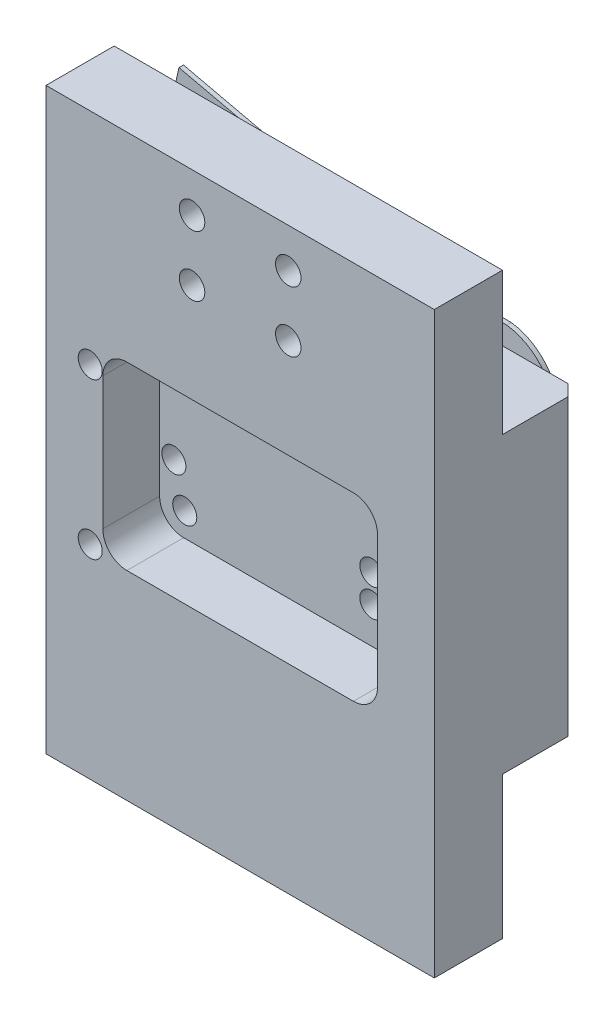
from build123d import *

# Parameters (mm, degrees)
CROQUIS1_R                 = 4.430496459
CROQUIS1_R_2               = 2.021537648
CROQUIS1_R_3               = 2.872174668
CROQUIS1_R_4               = 2.680697474
CROQUIS1_R_5               = 2.776444448
CROQUIS1_R_6               = 2.106249137
CROQUIS1_R_7               = 2.790383016
SALIENTE_EXTRUIR1_DEPTH    = 1.19
CROQUIS7_W                 = 102.52
CROQUIS7_H                 = 77.67
SALIENTE_EXTRUIR2_DEPTH    = 38.3
CROQUIS9_W                 = 102.52
CROQUIS9_H                 = 152.854
SALIENTE_EXTRUIR3_DEPTH    = 18
CROQUIS10_W                = 72.52
CROQUIS10_H                = 47.67
CORTAR_EXTRUIR2_DEPTH      = 15
CROQUIS8_R                 = 2.021537648
CROQUIS8_R_2               = 2.680697474
CROQUIS8_R_3               = 2.106249137
CROQUIS8_R_4               = 2.790383016
CORTAR_EXTRUIR3_DEPTH      = 3118.224162973
REDONDEO1_R                = 6.35
CROQUIS8_7_R               = 3.175
CORTAR_EXTRUIR4_DEPTH      = 38.3
CROQUIS11_R                = 3.175
CORTAR_EXTRUIR5_DEPTH      = 5
CHAFL_N1_SIZE              = 3
CORTAR_EXTRUIR6_DEPTH      = 3118.147929169
CORTAR_EXTRUIR6_DEPTH_BACK = 3118.147929169
CROQUIS12_R                = 3.3655
CORTAR_EXTRUIR7_DEPTH      = 3.0988
CROQUIS11_5_R              = 3.175
CORTAR_EXTRUIR8_DEPTH      = 3118.179679185


with BuildPart() as part:
    # Croquis1 → Saliente-Extruir1 (new body)
    with BuildSketch(Plane.XY):
        with BuildLine():
            Line((2788.515923591, 1163.062896503), (2845.320282862, 1163.062896503))
            ThreePointArc((2845.320282862, 1163.062896503), (2854.380265752, 1158.219977336), (2857.861371877, 1148.554623946))
            Line((2857.861371877, 1148.554623946), (2857.861371877, 1105.884683704))
            Line((2857.861371877, 1105.884683704), (2859.709564321, 1099.969499723))
            Line((2859.709564321, 1099.969499723), (2859.709564321, 1086.668463787))
            Line((2859.709564321, 1086.668463787), (2831.925019811, 1086.668463787))
            Line((2831.925019811, 1086.668463787), (2831.925019811, 1090.237043102))
            ThreePointArc((2831.925019811, 1090.237043102), (2830.339855276, 1092.909707682), (2827.46732338, 1094.094799688))
            Line((2827.46732338, 1094.094799688), (2781.073788136, 1094.094799688))
            ThreePointArc((2781.073788136, 1094.094799688), (2777.943377157, 1096.10205762), (2777.077273901, 1099.718467781))
            Line((2777.077273901, 1099.718467781), (2777.077273901, 1139.357764533))
            ThreePointArc((2777.077273901, 1139.357764533), (2776.16191908, 1141.931561181), (2774.31245647, 1143.941981956))
            Line((2774.31245647, 1143.941981956), (2760.508490421, 1156.27030536))
            Line((2760.508490421, 1156.27030536), (2756.869619555, 1168.884626052))
            ThreePointArc((2756.869619555, 1168.884626052), (2756.826740412, 1171.777711215), (2757.827792947, 1174.492425601))
            Line((2757.827792947, 1174.492425601), (2758.788780948, 1178.67068333))
            Line((2758.788780948, 1178.67068333), (2784.893128388, 1172.66675387))
            Line((2784.893128388, 1172.66675387), (2784.19129322, 1169.615260811))
            ThreePointArc((2784.19129322, 1169.615260811), (2784.56217485, 1165.156713392), (2788.515923591, 1163.062896503))
        make_face()
        with Locations((2819.601763615, 1133.235396685)):
            Circle(CROQUIS1_R, mode=Mode.SUBTRACT)
        with Locations((2790.727223865, 1121.638053324)):
            Circle(CROQUIS1_R_2, mode=Mode.SUBTRACT)
        with Locations((2783.65094449, 1147.375154376)):
            Circle(CROQUIS1_R_3, mode=Mode.SUBTRACT)
        with Locations((2793.607825607, 1111.419307874)):
            Circle(CROQUIS1_R_4, mode=Mode.SUBTRACT)
        with Locations((2783.65094449, 1106.253651095)):
            Circle(CROQUIS1_R_3, mode=Mode.SUBTRACT)
        with Locations((2842.913546585, 1132.266044758)):
            Circle(CROQUIS1_R_5, mode=Mode.SUBTRACT)
        with Locations((2843.009293559, 1122.033928625)):
            Circle(CROQUIS1_R_6, mode=Mode.SUBTRACT)
        with Locations((2843.009293559, 1114.670632569)):
            Circle(CROQUIS1_R_7, mode=Mode.SUBTRACT)
    extrude(amount=SALIENTE_EXTRUIR1_DEPTH)


with BuildPart() as body_2:
    # Croquis7 → Saliente-Extruir2 (new body)
    with BuildSketch(Plane.XY.offset(11.19)):
        with Locations((2823.237273901, 1128.929799688)):
            Rectangle(CROQUIS7_W, CROQUIS7_H)
    extrude(amount=SALIENTE_EXTRUIR2_DEPTH)

    # Croquis9 → Saliente-Extruir3 (add)
    with BuildSketch(Plane.XY.offset(49.49)):
        with Locations((2823.237273901, 1128.929799688)):
            Rectangle(CROQUIS9_W, CROQUIS9_H)
    extrude(amount=-SALIENTE_EXTRUIR3_DEPTH)

    # Croquis10 → Cortar-Extruir2 (cut)
    with BuildSketch(Plane.XY.offset(49.49)):
        with Locations((2823.237273901, 1128.929799688)):
            Rectangle(CROQUIS10_W, CROQUIS10_H)
    extrude(amount=-CORTAR_EXTRUIR2_DEPTH, mode=Mode.SUBTRACT)

    # Croquis8 → Cortar-Extruir3 (cut, through all)
    with BuildSketch(Plane(origin=(0, 0, 11.19), x_dir=(-1, 0, 0), z_dir=(0, 0, -1))):
        with Locations((-2790.727223865, 1121.638053324)):
            Circle(CROQUIS8_R)
        with Locations((-2793.607825607, 1111.419307874)):
            Circle(CROQUIS8_R_2)
        with Locations((-2843.009293559, 1122.033928625)):
            Circle(CROQUIS8_R_3)
        with Locations((-2843.009293559, 1114.670632569)):
            Circle(CROQUIS8_R_4)
    extrude(amount=-CORTAR_EXTRUIR3_DEPTH, mode=Mode.SUBTRACT)

    # Redondeo1
    redondeo1_edges = [body_2.edges().sort_by_distance(p)[0] for p in [
        (2859.497273901, 1152.764799688, 41.99),
        (2859.497273901, 1105.094799688, 41.99),
        (2786.977273901, 1105.094799688, 41.99),
        (2786.977273901, 1152.764799688, 41.99),
    ]]
    fillet(redondeo1_edges, radius=REDONDEO1_R)

    # Croquis8<7> → Cortar-Extruir4 (cut)
    with BuildSketch(Plane(origin=(0, 0, 11.19), x_dir=(-1, 0, 0), z_dir=(0, 0, -1))):
        with Locations((-2783.65094449, 1106.253651095)):
            Circle(CROQUIS8_7_R)
        with Locations((-2783.65094449, 1147.375154376)):
            Circle(CROQUIS8_7_R)
    extrude(amount=-CORTAR_EXTRUIR4_DEPTH, mode=Mode.SUBTRACT)

    # Croquis11 → Cortar-Extruir5 (cut)
    with BuildSketch(Plane.XY.offset(34.49)):
        with Locations((2843.009293559, 1122.033928625)):
            Circle(CROQUIS11_R)
        with Locations((2790.727223865, 1121.638053324)):
            Circle(CROQUIS11_R)
    extrude(amount=-CORTAR_EXTRUIR5_DEPTH, mode=Mode.SUBTRACT)

    # Chaflán1
    chafl_n1_edges = [body_2.edges().sort_by_distance(p)[0] for p in [
        (2874.497273901, 1128.929799688, 11.19),
    ]]
    chamfer(chafl_n1_edges, length=CHAFL_N1_SIZE)

    # Croquis12 → Cortar-Extruir6 (cut, two sides: drawn at the far end of the back side and taken through both)
    with BuildSketch(Plane(origin=(0, 0, 31.49), x_dir=(-1, 0, 0), z_dir=(0, 0, -1)).offset(-CORTAR_EXTRUIR6_DEPTH_BACK)):
        with Locations((-2835.937273901, 1194.942799688)):
            Circle(CROQUIS12_R)
        with Locations((-2835.937273901, 1178.940799688)):
            Circle(CROQUIS12_R)
        with Locations((-2810.537273901, 1178.940799688)):
            Circle(CROQUIS12_R)
        with Locations((-2810.537273901, 1194.942799688)):
            Circle(CROQUIS12_R)
    extrude(amount=CORTAR_EXTRUIR6_DEPTH + CORTAR_EXTRUIR6_DEPTH_BACK, mode=Mode.SUBTRACT)

    # Croquis13 → Cortar-Extruir7 (cut)
    with BuildSketch(Plane(origin=(0, 0, 31.49), x_dir=(-1, 0, 0), z_dir=(0, 0, -1))):
        with BuildLine():
            Line((-2807.489273901, 1202.816799688), (-2838.985273901, 1202.816799688))
            ThreePointArc((-2838.985273901, 1202.816799688), (-2841.320140493, 1201.84966628), (-2842.287273901, 1199.514799688))
            Line((-2842.287273901, 1199.514799688), (-2842.287273901, 1174.368799688))
            ThreePointArc((-2842.287273901, 1174.368799688), (-2841.320140493, 1172.033933097), (-2838.985273901, 1171.066799688))
            Line((-2838.985273901, 1171.066799688), (-2807.489273901, 1171.066799688))
            ThreePointArc((-2807.489273901, 1171.066799688), (-2805.15440731, 1172.033933097), (-2804.187273901, 1174.368799688))
            Line((-2804.187273901, 1174.368799688), (-2804.187273901, 1199.514799688))
            ThreePointArc((-2804.187273901, 1199.514799688), (-2805.15440731, 1201.84966628), (-2807.489273901, 1202.816799688))
        make_face()
    extrude(amount=-CORTAR_EXTRUIR7_DEPTH, mode=Mode.SUBTRACT)

    # Croquis11<5> → Cortar-Extruir8 (cut, through all)
    with BuildSketch(Plane.XY.offset(34.49)):
        with Locations((2843.009293559, 1114.670632569)):
            Circle(CROQUIS11_5_R)
        with Locations((2793.607825607, 1111.419307874)):
            Circle(CROQUIS11_5_R)
    extrude(amount=-CORTAR_EXTRUIR8_DEPTH, mode=Mode.SUBTRACT)


solid = Compound([part.part, body_2.part])
